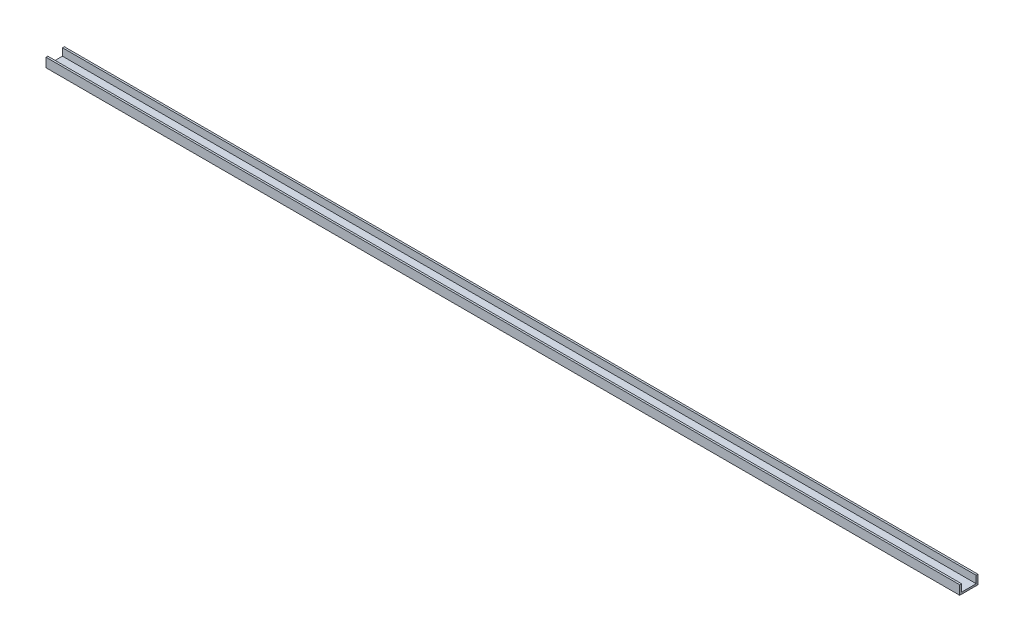
from build123d import *

# Parameters (mm, degrees)
BOSS_EXTRUDE1_DEPTH = 1000


with BuildPart() as part:
    # Sketch2 → Boss-Extrude1 (new body)
    with BuildSketch(Plane(origin=(0, 0, 0), x_dir=(0, 0, -1), z_dir=(1, 0, 0))):
        Polygon((0, 10), (0, 0), (20, 0), (20, 10), (18, 10), (18, 2), (2, 2), (2, 10), align=None)
    extrude(amount=BOSS_EXTRUDE1_DEPTH)


solid = part.part
